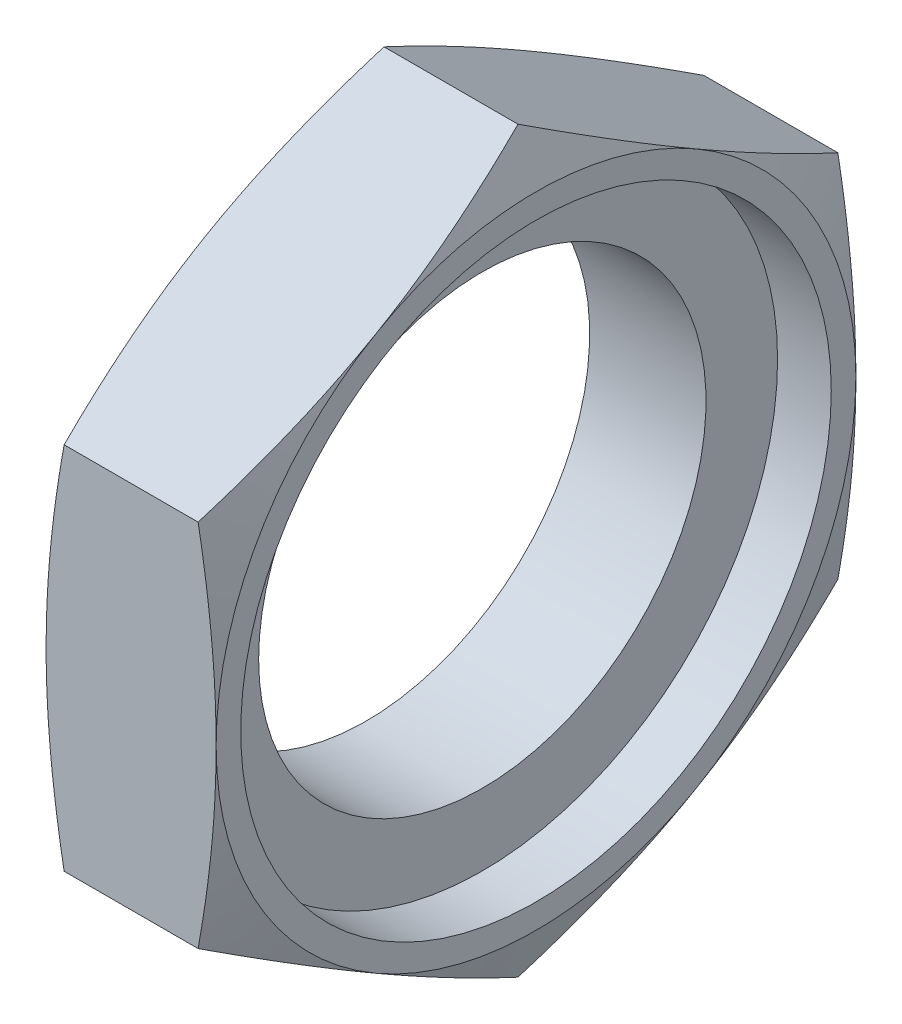
from build123d import *

# Parameters (mm, degrees)
ESBO_O1_R                = 10
RESSALTO_EXTRUS_O1_DEPTH = 7.6
ESBO_O9_OUTSIDE_W        = 114.11
ESBO_O9_OUTSIDE_H        = 118.534
ESBO_O9_OUTSIDE_R        = 14.3
CORTE_EXTRUS_O3_DEPTH    = 10
CORTE_EXTRUS_O3_DRAFT    = -75
ESBO_O10_OUTSIDE_W       = 151.43
ESBO_O10_OUTSIDE_H       = 155.854
ESBO_O10_OUTSIDE_R       = 14.3
CORTE_EXTRUS_O5_DEPTH    = 15
CORTE_EXTRUS_O5_DRAFT    = -75
FURO1_D                  = 26.4
FURO1_DEPTH              = 2.4
ESBO_O7_OUTSIDE_W        = 110.904
ESBO_O7_OUTSIDE_H        = 115.328
ESBO_O7_OUTSIDE_R        = 14.3
CORTE_EXTRUS_O1_DEPTH    = 13
CORTE_EXTRUS_O1_DRAFT    = -70
ESBO_O8_OUTSIDE_W        = 110.904
ESBO_O8_OUTSIDE_H        = 115.328
ESBO_O8_OUTSIDE_R        = 14.3
CORTE_EXTRUS_O2_DEPTH    = 13
CORTE_EXTRUS_O2_DRAFT    = -70


with BuildPart() as part:
    # Esboço1 → Ressalto-extrusão1 (new body)
    with BuildSketch(Plane(origin=(0, 0, 0), x_dir=(0, 0, -1), z_dir=(1, 0, 0))):
        Polygon((14.3, 8.256108849), (0, 16.512217699), (-14.3, 8.256108849), (-14.3, -8.256108849), (0, -16.512217699), (14.3, -8.256108849), align=None)
        with Locations(Location((0, 0, 0), (0, 0, 180))):
            Circle(ESBO_O1_R, mode=Mode.SUBTRACT)
    extrude(amount=RESSALTO_EXTRUS_O1_DEPTH)


with BuildPart() as corte_extrus_o3_tool:
    # Esboço9 outside → Corte-extrusão3 (with draft: the straight prism first)
    with BuildSketch(Plane.ZY):
        Rectangle(ESBO_O9_OUTSIDE_W, ESBO_O9_OUTSIDE_H)
        Circle(ESBO_O9_OUTSIDE_R, mode=Mode.SUBTRACT)
    extrude(amount=-CORTE_EXTRUS_O3_DEPTH)
    # Corte-extrusão3: the draft: its side faces are tilted about the plane it starts from
    corte_extrus_o3_sides = [corte_extrus_o3_tool.faces().sort_by_distance(p)[0] for p in [
        (5, -59.267, 0),
        (5, 0, 57.055),
        (5, 59.267, 0),
        (5, 0, -57.055),
        (5, 0, -14.3),
    ]]
    draft(corte_extrus_o3_sides, Plane.ZY, CORTE_EXTRUS_O3_DRAFT)


with BuildPart() as part_1:
    add(part.part)

    # Corte-extrusão3: cut by corte_extrus_o3_tool
    add(corte_extrus_o3_tool.part, mode=Mode.SUBTRACT)


with BuildPart() as corte_extrus_o5_tool:
    # Esboço10 outside → Corte-extrusão5 (with draft: the straight prism first)
    with BuildSketch(Plane(origin=(7.6, 0, 0), x_dir=(0, 0, -1), z_dir=(1, 0, 0))):
        Rectangle(ESBO_O10_OUTSIDE_W, ESBO_O10_OUTSIDE_H)
        Circle(ESBO_O10_OUTSIDE_R, mode=Mode.SUBTRACT)
    extrude(amount=-CORTE_EXTRUS_O5_DEPTH)
    # Corte-extrusão5: the draft: its side faces are tilted about the plane it starts from
    corte_extrus_o5_sides = [corte_extrus_o5_tool.faces().sort_by_distance(p)[0] for p in [
        (0.1, -77.927, 0),
        (0.1, 0, -75.715),
        (0.1, 77.927, 0),
        (0.1, 0, 75.715),
        (0.1, 0, 14.3),
    ]]
    draft(corte_extrus_o5_sides, Plane(origin=(7.6, 0, 0), x_dir=(0, 0, -1), z_dir=(1, 0, 0)), CORTE_EXTRUS_O5_DRAFT)


with BuildPart() as part_2:
    add(part_1.part)

    # Corte-extrusão5: cut by corte_extrus_o5_tool
    add(corte_extrus_o5_tool.part, mode=Mode.SUBTRACT)

    # Furo1
    with Locations(Plane(origin=(7.6, 0, 0), x_dir=(0, 0, -1), z_dir=(1, 0, 0))):
        with Locations((0, 0)):
            Hole(FURO1_D / 2, depth=FURO1_DEPTH)


with BuildPart() as corte_extrus_o1_tool:
    # Esboço7 outside → Corte-extrusão1 (with draft: the straight prism first)
    with BuildSketch(Plane(origin=(7.6, 0, 0), x_dir=(0, 0, -1), z_dir=(1, 0, 0))):
        Rectangle(ESBO_O7_OUTSIDE_W, ESBO_O7_OUTSIDE_H)
        Circle(ESBO_O7_OUTSIDE_R, mode=Mode.SUBTRACT)
    extrude(amount=-CORTE_EXTRUS_O1_DEPTH)
    # Corte-extrusão1: the draft: its side faces are tilted about the plane it starts from
    corte_extrus_o1_sides = [corte_extrus_o1_tool.faces().sort_by_distance(p)[0] for p in [
        (1.1, -57.664, 0),
        (1.1, 0, -55.452),
        (1.1, 57.664, 0),
        (1.1, 0, 55.452),
        (1.1, 0, 14.3),
    ]]
    draft(corte_extrus_o1_sides, Plane(origin=(7.6, 0, 0), x_dir=(0, 0, -1), z_dir=(1, 0, 0)), CORTE_EXTRUS_O1_DRAFT)


with BuildPart() as part_3:
    add(part_2.part)

    # Corte-extrusão1: cut by corte_extrus_o1_tool
    add(corte_extrus_o1_tool.part, mode=Mode.SUBTRACT)


with BuildPart() as corte_extrus_o2_tool:
    # Esboço8 outside → Corte-extrusão2 (with draft: the straight prism first)
    with BuildSketch(Plane.ZY):
        Rectangle(ESBO_O8_OUTSIDE_W, ESBO_O8_OUTSIDE_H)
        Circle(ESBO_O8_OUTSIDE_R, mode=Mode.SUBTRACT)
    extrude(amount=-CORTE_EXTRUS_O2_DEPTH)
    # Corte-extrusão2: the draft: its side faces are tilted about the plane it starts from
    corte_extrus_o2_sides = [corte_extrus_o2_tool.faces().sort_by_distance(p)[0] for p in [
        (6.5, -57.664, 0),
        (6.5, 0, 55.452),
        (6.5, 57.664, 0),
        (6.5, 0, -55.452),
        (6.5, 0, -14.3),
    ]]
    draft(corte_extrus_o2_sides, Plane.ZY, CORTE_EXTRUS_O2_DRAFT)


with BuildPart() as part_4:
    add(part_3.part)

    # Corte-extrusão2: cut by corte_extrus_o2_tool
    add(corte_extrus_o2_tool.part, mode=Mode.SUBTRACT)


solid = part_4.part
